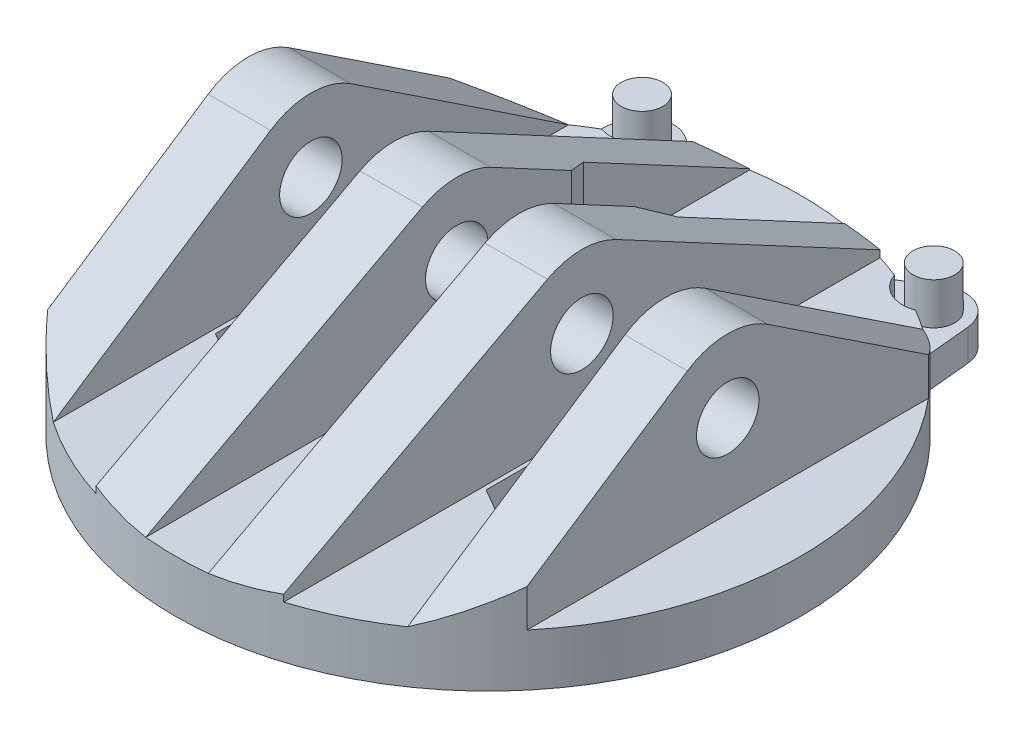
from build123d import *
from build123d.topology import SkipClean

# Parameters (mm, degrees)
SKETCH1_R           = 30
SKETCH1_R_2         = 2.1
BOSS_EXTRUDE1_DEPTH = 5
CUT_EXTRUDE2_DEPTH  = 2
BOSS_EXTRUDE5_DEPTH = 15
SKETCH8_R           = 3
CUT_EXTRUDE3_DEPTH  = 65.101482042
CUT_EXTRUDE4_REACH  = 50.877
CUT_EXTRUDE5_REACH  = 61.237
BOSS_EXTRUDE8_DEPTH = 3
CUT_EXTRUDE8_START  = -2
CUT_EXTRUDE8_DEPTH  = 2
SKETCH14_R          = 2
BOSS_EXTRUDE9_DEPTH = 4


with BuildPart() as part:
    # Sketch1 → Boss-Extrude1 (new body)
    with BuildSketch(Plane(origin=(0, 0, 0), x_dir=(1, 0, 0), z_dir=(0, 1, 0))):
        with Locations(Location((0, 0, 0), (0, 0, 270))):
            Circle(SKETCH1_R)
        with Locations(Location((0, 15, 0), (0, 0, 270))):
            Circle(SKETCH1_R_2, mode=Mode.SUBTRACT)
        with Locations(Location((12.990381057, -7.5, 0), (0, 0, 270))):
            Circle(SKETCH1_R_2, mode=Mode.SUBTRACT)
        with Locations(Location((-12.990381057, -7.5, 0), (0, 0, 270))):
            Circle(SKETCH1_R_2, mode=Mode.SUBTRACT)
    extrude(amount=BOSS_EXTRUDE1_DEPTH)

    # Sketch7 → Cut-Extrude2 (cut)
    with BuildSketch(Plane(origin=(0, 5, 0), x_dir=(1, 0, 0), z_dir=(0, 1, 0))):
        Polygon((0, 19.156921938), (-3.6, 17.078460969), (-3.6, 12.921539031), (0, 10.843078062), (3.6, 12.921539031), (3.6, 17.078460969), align=None)
        Polygon((12.990381057, -3.343078062), (9.390381057, -5.421539031), (9.390381057, -9.578460969), (12.990381057, -11.656921938), (16.590381057, -9.578460969), (16.590381057, -5.421539031), align=None)
        Polygon((-12.990381057, -3.343078062), (-16.590381057, -5.421539031), (-16.590381057, -9.578460969), (-12.990381057, -11.656921938), (-9.390381057, -9.578460969), (-9.390381057, -5.421539031), align=None)
    extrude(amount=-CUT_EXTRUDE2_DEPTH, mode=Mode.SUBTRACT)

    # Sketch2 → Boss-Extrude5 (add)
    with BuildSketch(Plane(origin=(0, 5, 0), x_dir=(1, 0, 0), z_dir=(0, 1, 0))):
        with BuildLine():
            Line((23, -19.261360284), (23, 19.261360284))
            ThreePointArc((23, 19.261360284), (20.18526342, 22.193583322), (17, 24.718414189))
            Line((17, 24.718414189), (17, -24.718414189))
            ThreePointArc((17, -24.718414189), (20.18526342, -22.193583322), (23, -19.261360284))
        make_face()
        with BuildLine():
            Line((9, -28.618176043), (9, 28.618176043))
            ThreePointArc((9, 28.618176043), (6.798137481, 29.219605178), (4.556921938, 29.651888008))
            Line((4.556921938, 29.651888008), (4.556921938, 13.6966679))
            Line((4.556921938, 13.6966679), (3, 11))
            Line((3, 11), (3, -29.849623113))
            ThreePointArc((3, -29.849623113), (6.031510215, -29.387427321), (9, -28.618176043))
        make_face()
    boss_extrude5 = extrude(amount=BOSS_EXTRUDE5_DEPTH)

    # Sketch8 → Cut-Extrude3 (cut, through all)
    with BuildSketch(Plane(origin=(23, 0, 0), x_dir=(0, 0, -1), z_dir=(1, 0, 0))):
        with Locations((0, 13)):
            Circle(SKETCH8_R)
    cut_extrude3 = extrude(amount=-CUT_EXTRUDE3_DEPTH, mode=Mode.SUBTRACT)

    # Sketch9 → Cut-Extrude4 (cut, up to next)
    with BuildSketch(Plane.ZY.offset(-3), mode=Mode.PRIVATE) as cut_extrude4_sk1:
        Polygon((-29.651888008, 20), (-29.651888008, 5.105559505), (-11, 15.062739712), (-11, 20), (-13.6966679, 20), align=None)
    cut_extrude4_tool1 = extrude(cut_extrude4_sk1.sketch, amount=-CUT_EXTRUDE4_REACH, mode=Mode.PRIVATE) & part.part
    # Sketch9 → Cut-Extrude4 (cut, up to next)
    with BuildSketch(Plane.ZY.offset(-3), mode=Mode.PRIVATE) as cut_extrude4_sk2:
        with BuildLine():
            Line((-11, 20), (-11, 15.062739712))
            Line((-11, 15.062739712), (-3.29656778, 19.175163226))
            ThreePointArc((-3.29656778, 19.175163226), (-1.699096439, 19.790660593), (0, 20))
            Line((0, 20), (-11, 20))
        make_face()
    cut_extrude4_tool2 = extrude(cut_extrude4_sk2.sketch, amount=-CUT_EXTRUDE4_REACH, mode=Mode.PRIVATE) & part.part
    # Sketch9 → Cut-Extrude4 (cut, up to next)
    with BuildSketch(Plane.ZY.offset(-3), mode=Mode.PRIVATE) as cut_extrude4_sk3:
        with BuildLine():
            Line((29.849623113, 20), (0, 20))
            ThreePointArc((0, 20), (1.699096439, 19.790660593), (3.29656778, 19.175163226))
            Line((3.29656778, 19.175163226), (29.849623113, 5))
            Line((29.849623113, 5), (29.849623113, 20))
        make_face()
    cut_extrude4_tool3 = extrude(cut_extrude4_sk3.sketch, amount=-CUT_EXTRUDE4_REACH, mode=Mode.PRIVATE) & part.part
    cut_extrude4_1 = cut_extrude4_tool1.solids().sort_by_distance((3, 14.625463, -21.886747))[0]
    add(cut_extrude4_1, mode=Mode.SUBTRACT)
    cut_extrude4_2 = cut_extrude4_tool2.solids().sort_by_distance((3, 18.370055, -7.850815))[0]
    add(cut_extrude4_2, mode=Mode.SUBTRACT)
    cut_extrude4_3 = cut_extrude4_tool3.solids().sort_by_distance((3, 15.00565, 20.461626))[0]
    add(cut_extrude4_3, mode=Mode.SUBTRACT)
    cut_extrude4 = cut_extrude4_1 + cut_extrude4_2 + cut_extrude4_3  # Cut-Extrude4 as one shape, for the pattern or mirror that repeats it

    # Sketch10 → Cut-Extrude5 (cut, up to next)
    with BuildSketch(Plane.ZY.offset(-17), mode=Mode.PRIVATE) as cut_extrude5_sk1:
        with BuildLine():
            Line((-24.718414189, 20), (-24.718414189, 5))
            Line((-24.718414189, 5), (-3.870106441, 18.832861745))
            ThreePointArc((-3.870106441, 18.832861745), (-2.021134326, 19.701866608), (-3.6e-08, 20))
            Line((-3.6e-08, 20), (-24.718414189, 20))
        make_face()
    cut_extrude5_tool1 = extrude(cut_extrude5_sk1.sketch, amount=-CUT_EXTRUDE5_REACH, mode=Mode.PRIVATE) & part.part
    # Sketch10 → Cut-Extrude5 (cut, up to next)
    with BuildSketch(Plane.ZY.offset(-17), mode=Mode.PRIVATE) as cut_extrude5_sk2:
        with BuildLine():
            Line((3.870106441, 18.832861745), (24.718414189, 5))
            Line((24.718414189, 5), (24.718414189, 20))
            Line((24.718414189, 20), (-3.6e-08, 20))
            ThreePointArc((-3.6e-08, 20), (2.021134291, 19.701866619), (3.870106441, 18.832861745))
        make_face()
    cut_extrude5_tool2 = extrude(cut_extrude5_sk2.sketch, amount=-CUT_EXTRUDE5_REACH, mode=Mode.PRIVATE) & part.part
    cut_extrude5_1 = cut_extrude5_tool1.solids().sort_by_distance((17, 15.01191, -17.14476))[0]
    add(cut_extrude5_1, mode=Mode.SUBTRACT)
    cut_extrude5_2 = cut_extrude5_tool2.solids().sort_by_distance((17, 15.01191, 17.14476))[0]
    add(cut_extrude5_2, mode=Mode.SUBTRACT)
    cut_extrude5 = cut_extrude5_1 + cut_extrude5_2  # Cut-Extrude5 as one shape, for the pattern or mirror that repeats it

    # Mirror1: Boss-Extrude5, Cut-Extrude3, Cut-Extrude4, Cut-Extrude5 across plane
    with SkipClean():  # the faces are left unmerged after this step: merging them gives an invalid solid
        add(boss_extrude5.mirror(Plane.ZY))
        add(cut_extrude3.mirror(Plane.ZY), mode=Mode.SUBTRACT)
        add(cut_extrude4.mirror(Plane.ZY), mode=Mode.SUBTRACT)
        add(cut_extrude5.mirror(Plane.ZY), mode=Mode.SUBTRACT)

    # Sketch13 → Boss-Extrude8 (add)
    with SkipClean():  # the faces are left unmerged after this step: merging them gives an invalid solid
        with BuildSketch(Plane.XZ):
            with BuildLine():
                ThreePointArc((12.385089192, -31.30324211), (15.3125, -31.472644372), (16.98597293, -29.064757431))
                Line((16.98597293, -29.064757431), (17.437516579, -24.411739298))
                ThreePointArc((17.437516579, -24.411739298), (13.125, -26.976552319), (8.445332472, -28.786739298))
                Line((8.445332472, -28.786739298), (12.385089192, -31.30324211))
            make_face()
        boss_extrude8 = extrude(amount=-BOSS_EXTRUDE8_DEPTH)

    # Sketch15 → Cut-Extrude8 (cut)
    with SkipClean():  # the faces are left unmerged after this step: merging them gives an invalid solid
        with BuildSketch(Plane(origin=(0, 5, 0), x_dir=(1, 0, 0), z_dir=(0, 1, 0)).offset(CUT_EXTRUDE8_START)):
            with BuildLine():
                ThreePointArc((15.036417377, 25.959702472), (13.125, 26.976552319), (11.145223248, 27.852899288))
                ThreePointArc((11.145223248, 27.852899288), (12.6875, 26.077333908), (15.036417377, 25.959702472))
            make_face()
            with BuildLine():
                ThreePointArc((17, 28.77498914), (13.533272165, 31.738460943), (11.145223248, 27.852899288))
                ThreePointArc((11.145223248, 27.852899288), (13.125, 26.976552319), (15.036417377, 25.959702472))
                ThreePointArc((15.036417377, 25.959702472), (16.460614977, 27.058779964), (17, 28.77498914))
            make_face()
        cut_extrude8 = extrude(amount=CUT_EXTRUDE8_DEPTH, mode=Mode.SUBTRACT)

    # Sketch14 → Boss-Extrude9 (add)
    with SkipClean():  # the faces are left unmerged after this step: merging them gives an invalid solid
        with BuildSketch(Plane(origin=(0, 3, 0), x_dir=(1, 0, 0), z_dir=(0, 1, 0))):
            with Locations(Location((14, 28.77498914, 0), (0, 0, 90))):
                Circle(SKETCH14_R)
        boss_extrude9 = extrude(amount=BOSS_EXTRUDE9_DEPTH)

    # Mirror2: Boss-Extrude8, Cut-Extrude8, Boss-Extrude9 across plane
    with SkipClean():  # the faces are left unmerged after this step: merging them gives an invalid solid
        add(boss_extrude8.mirror(Plane.ZY))
        add(cut_extrude8.mirror(Plane.ZY), mode=Mode.SUBTRACT)
        add(boss_extrude9.mirror(Plane.ZY))


solid = part.part
